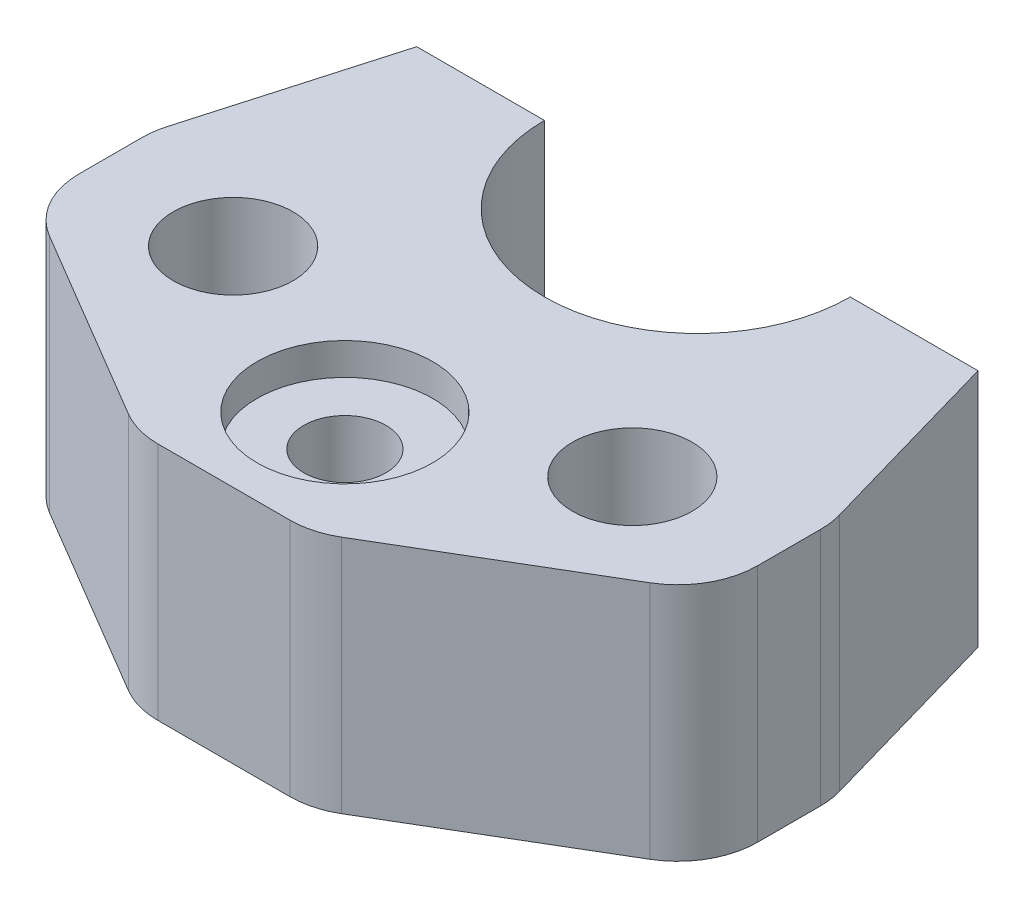
from build123d import *

# Parameters (mm, degrees)
SKETCH2_R           = 7.5
BOSS_EXTRUDE1_DEPTH = 30
FILLET1_R           = 10
SKETCH4_R           = 11
CUT_EXTRUDE1_DEPTH  = 4


with BuildPart() as part:
    # Sketch2 → Boss-Extrude1 (new body)
    # profile 1 of 6: a face of its own
    with BuildSketch(Plane(origin=(0, 0, 0), x_dir=(1, 0, 0), z_dir=(0, 1, 0))):
        with BuildLine():
            Line((0, -33.15), (0, -19.15))
            ThreePointArc((0, -19.15), (-13.54109486, -13.54109486), (-19.15, 0))
            Line((-19.15, 0), (-35.15, 0))
            Line((-35.15, 0), (-42.5, -25.65))
            Line((-42.5, -25.65), (-42.5, -40.65))
            Line((-42.5, -40.65), (-11, -59.3))
            Line((-11, -59.3), (0, -59.3))
            Line((0, -59.3), (0, -55.15))
            ThreePointArc((0, -55.15), (-11, -44.15), (0, -33.15))
        make_face()
        with Locations(Location((-25, -33.15, 0), (0, 0, 270))):
            Circle(SKETCH2_R, mode=Mode.SUBTRACT)
    # profile 2 of 6: a face of its own
    with BuildSketch(Plane(origin=(0, 0, 0), x_dir=(1, 0, 0), z_dir=(0, 1, 0))):
        with BuildLine():
            ThreePointArc((19.15, 0), (13.54109486, -13.54109486), (0, -19.15))
            Line((0, -19.15), (0, -33.15))
            ThreePointArc((0, -33.15), (7.778174593, -36.371825407), (11, -44.15))
            ThreePointArc((11, -44.15), (7.778174593, -51.928174593), (0, -55.15))
            Line((0, -55.15), (0, -59.3))
            Line((0, -59.3), (11, -59.3))
            Line((11, -59.3), (42.5, -40.65))
            Line((42.5, -40.65), (42.5, -25.65))
            Line((42.5, -25.65), (35.15, 0))
            Line((35.15, 0), (19.15, 0))
        make_face()
        with Locations(Location((25, -33.15, 0), (0, 0, 270))):
            Circle(SKETCH2_R, mode=Mode.SUBTRACT)
    # profile 3 of 6: a face of its own
    with BuildSketch(Plane(origin=(0, 0, 0), x_dir=(1, 0, 0), z_dir=(0, 1, 0))):
        with BuildLine():
            ThreePointArc((11, -44.15), (7.778174593, -36.371825407), (0, -33.15))
            Line((0, -33.15), (0, -39))
            ThreePointArc((0, -39), (3.641599923, -40.508400077), (5.15, -44.15))
            ThreePointArc((5.15, -44.15), (3.641599923, -47.791599923), (0, -49.3))
            Line((0, -49.3), (0, -55.15))
            ThreePointArc((0, -55.15), (7.778174593, -51.928174593), (11, -44.15))
        make_face()
    # profile 4 of 6: a face of its own
    with BuildSketch(Plane(origin=(0, 0, 0), x_dir=(1, 0, 0), z_dir=(0, 1, 0))):
        with BuildLine():
            Line((0, -39), (0, -33.15))
            ThreePointArc((0, -33.15), (-11, -44.15), (0, -55.15))
            Line((0, -55.15), (0, -49.3))
            ThreePointArc((0, -49.3), (-5.15, -44.15), (0, -39))
        make_face()
    # profile 5 of 6: a face of its own
    with BuildSketch(Plane(origin=(0, 0, 0), x_dir=(1, 0, 0), z_dir=(0, 1, 0))):
        with BuildLine():
            ThreePointArc((11, -44.15), (7.778174593, -36.371825407), (0, -33.15))
            Line((0, -33.15), (0, -39))
            ThreePointArc((0, -39), (3.641599923, -40.508400077), (5.15, -44.15))
            ThreePointArc((5.15, -44.15), (3.641599923, -47.791599923), (0, -49.3))
            Line((0, -49.3), (0, -55.15))
            ThreePointArc((0, -55.15), (7.778174593, -51.928174593), (11, -44.15))
        make_face()
    # profile 6 of 6: a face of its own
    with BuildSketch(Plane(origin=(0, 0, 0), x_dir=(1, 0, 0), z_dir=(0, 1, 0))):
        with BuildLine():
            Line((0, -39), (0, -33.15))
            ThreePointArc((0, -33.15), (-11, -44.15), (0, -55.15))
            Line((0, -55.15), (0, -49.3))
            ThreePointArc((0, -49.3), (-5.15, -44.15), (0, -39))
        make_face()
    extrude(amount=BOSS_EXTRUDE1_DEPTH)

    # Fillet1
    fillet1_edges = [part.edges().sort_by_distance(p)[0] for p in [
        (42.5, 15, 25.65),
        (42.5, 15, 40.65),
        (11, 15, 59.3),
        (-11, 15, 59.3),
        (-42.5, 15, 40.65),
        (-42.5, 15, 25.65),
    ]]
    fillet(fillet1_edges, radius=FILLET1_R)

    # Sketch4 → Cut-Extrude1 (cut)
    with BuildSketch(Plane(origin=(0, 30, 0), x_dir=(1, 0, 0), z_dir=(0, 1, 0))):
        with Locations(Location((0, -44.15, 0), (0, 0, 270))):
            Circle(SKETCH4_R)
    extrude(amount=-CUT_EXTRUDE1_DEPTH, mode=Mode.SUBTRACT)


solid = part.part
